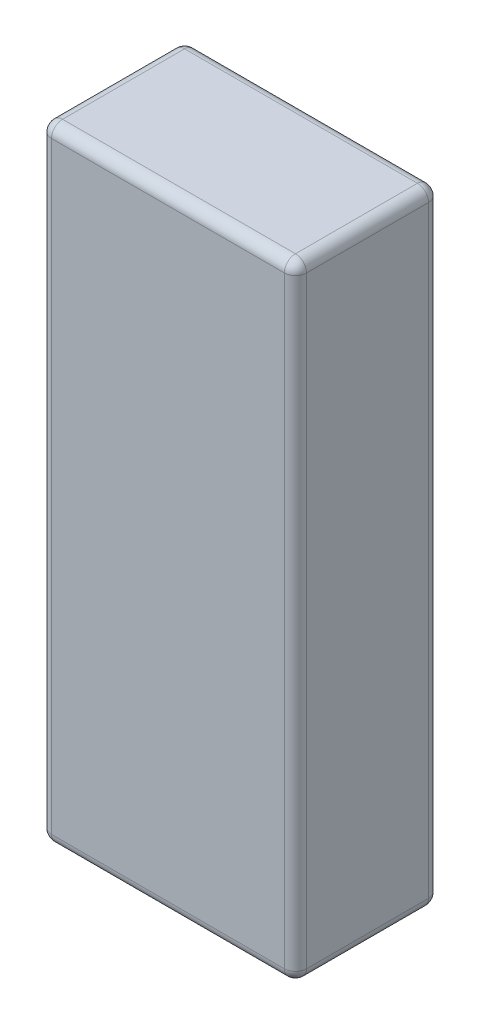
from build123d import *

# Parameters (mm, degrees)
SKETCH1_W           = 69
SKETCH1_H           = 169
BOSS_EXTRUDE1_DEPTH = 19.5
FILLET1_R           = 3


with BuildPart() as part:
    # Sketch1 → Boss-Extrude1 (new, symmetric)
    with BuildSketch(Plane.XY):
        Rectangle(SKETCH1_W, SKETCH1_H)
    extrude(amount=BOSS_EXTRUDE1_DEPTH, both=True)

    # Fillet1
    fillet1_edges = [part.edges().sort_by_distance(p)[0] for p in [
        (-34.5, 0, 19.5),
        (0, -84.5, 19.5),
        (34.5, 0, 19.5),
        (0, -84.5, -19.5),
        (-34.5, 0, -19.5),
        (0, 84.5, -19.5),
        (34.5, 0, -19.5),
        (0, 84.5, 19.5),
        (34.5, -84.5, 0),
        (-34.5, -84.5, 0),
        (-34.5, 84.5, 0),
        (34.5, 84.5, 0),
    ]]
    fillet(fillet1_edges, radius=FILLET1_R)


solid = part.part
